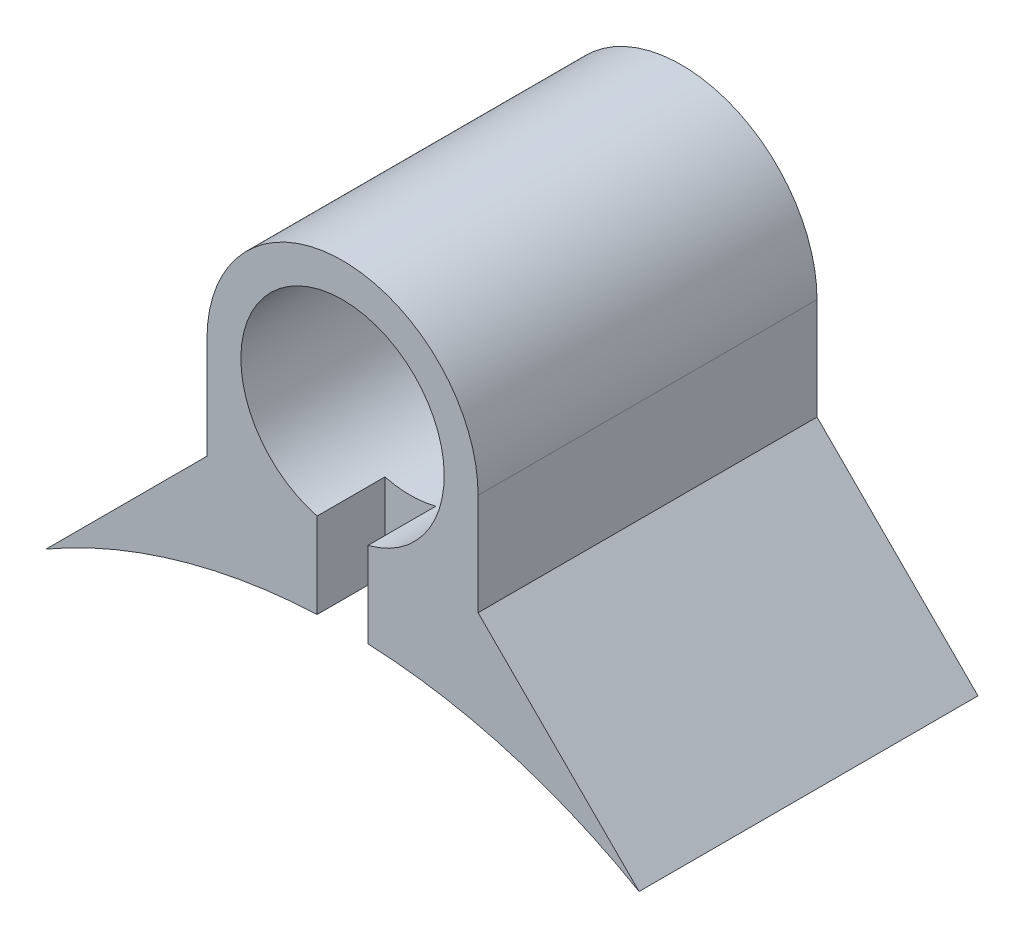
from build123d import *

# Parameters (mm, degrees)
SKETCH1_R           = 3
BOSS_EXTRUDE1_DEPTH = 10
CUT_EXTRUDE1_START  = -2
CUT_EXTRUDE1_DEPTH  = 2


with BuildPart() as part:
    # Sketch1 → Boss-Extrude1 (new body)
    with BuildSketch(Plane.XY):
        with BuildLine():
            Line((-8.75, 15.155444566), (-4, 19.905444566))
            Line((-4, 19.905444566), (-4, 22.905444566))
            ThreePointArc((-4, 22.905444566), (0, 26.905444566), (4, 22.905444566))
            Line((4, 22.905444566), (4, 19.905444566))
            Line((4, 19.905444566), (8.75, 15.155444566))
            ThreePointArc((8.75, 15.155444566), (0, 17.5), (-8.75, 15.155444566))
        make_face()
        with Locations((0, 22.905444566)):
            Circle(SKETCH1_R, mode=Mode.SUBTRACT)
    extrude(amount=BOSS_EXTRUDE1_DEPTH)

    # Sketch3 → Cut-Extrude1 (cut)
    with BuildSketch(Plane.XY.offset(10).offset(CUT_EXTRUDE1_START)):
        with BuildLine():
            ThreePointArc((0.75, 20.000707057), (0.378012877, 19.929355477), (0, 19.905444566))
            Line((0, 19.905444566), (0, 18.799598559))
            Line((0, 18.799598559), (0.75, 18.799598559))
            Line((0.75, 18.799598559), (0.75, 20.000707057))
        make_face()
        with BuildLine():
            Line((0, 18.799598559), (0, 19.905444566))
            ThreePointArc((0, 19.905444566), (-0.378012877, 19.929355477), (-0.75, 20.000707057))
            Line((-0.75, 20.000707057), (-0.75, 18.799598559))
            Line((-0.75, 18.799598559), (0, 18.799598559))
        make_face()
        with BuildLine():
            Line((0.75, 18.799598559), (0, 18.799598559))
            Line((0, 18.799598559), (0, 17.5))
            ThreePointArc((0, 17.5), (0.375086166, 17.495979834), (0.75, 17.483921185))
            Line((0.75, 17.483921185), (0.75, 18.799598559))
        make_face()
        with BuildLine():
            Line((0, 17.5), (0, 18.799598559))
            Line((0, 18.799598559), (-0.75, 18.799598559))
            Line((-0.75, 18.799598559), (-0.75, 17.483921185))
            ThreePointArc((-0.75, 17.483921185), (-0.375086166, 17.495979834), (0, 17.5))
        make_face()
    extrude(amount=CUT_EXTRUDE1_DEPTH, mode=Mode.SUBTRACT)


solid = part.part
